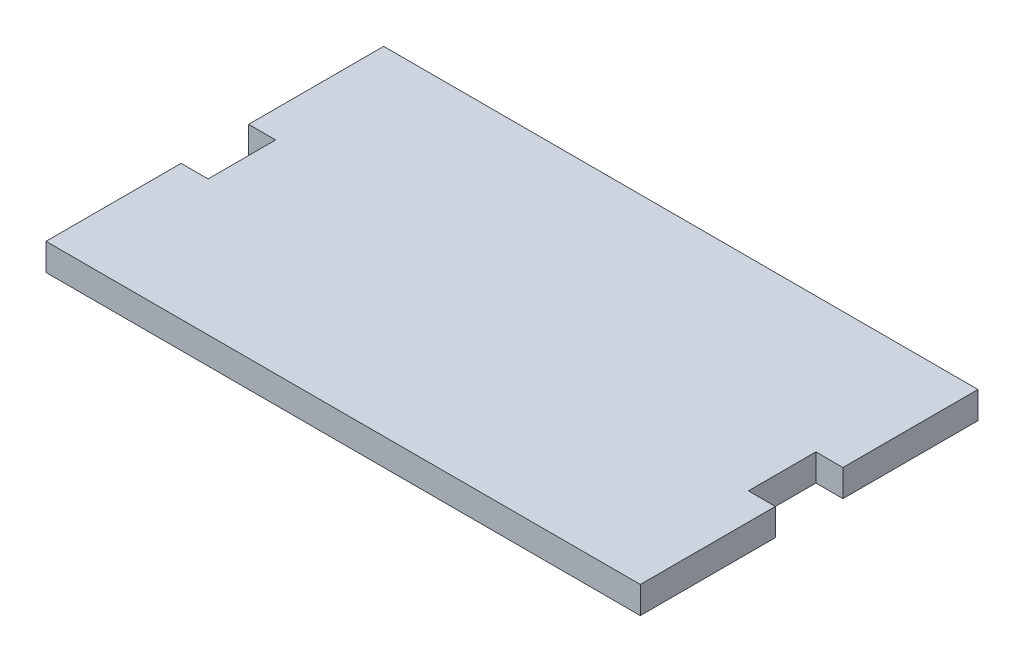
from build123d import *

# Parameters (mm, degrees)
BOSS_EXTRU_1_DEPTH = 4


with BuildPart() as part:
    # Esquisse1 → Boss.-Extru.1 (new body)
    with BuildSketch(Plane(origin=(0, 0, 0), x_dir=(1, 0, 0), z_dir=(0, 1, 0))):
        Polygon((-88, 30), (-88, 50), (0, 50), (0, 30), (-4, 30), (-4, 20), (0, 20), (0, 0), (-88, 0), (-88, 20), (-84, 20), (-84, 30), align=None)
    extrude(amount=BOSS_EXTRU_1_DEPTH)


solid = part.part
